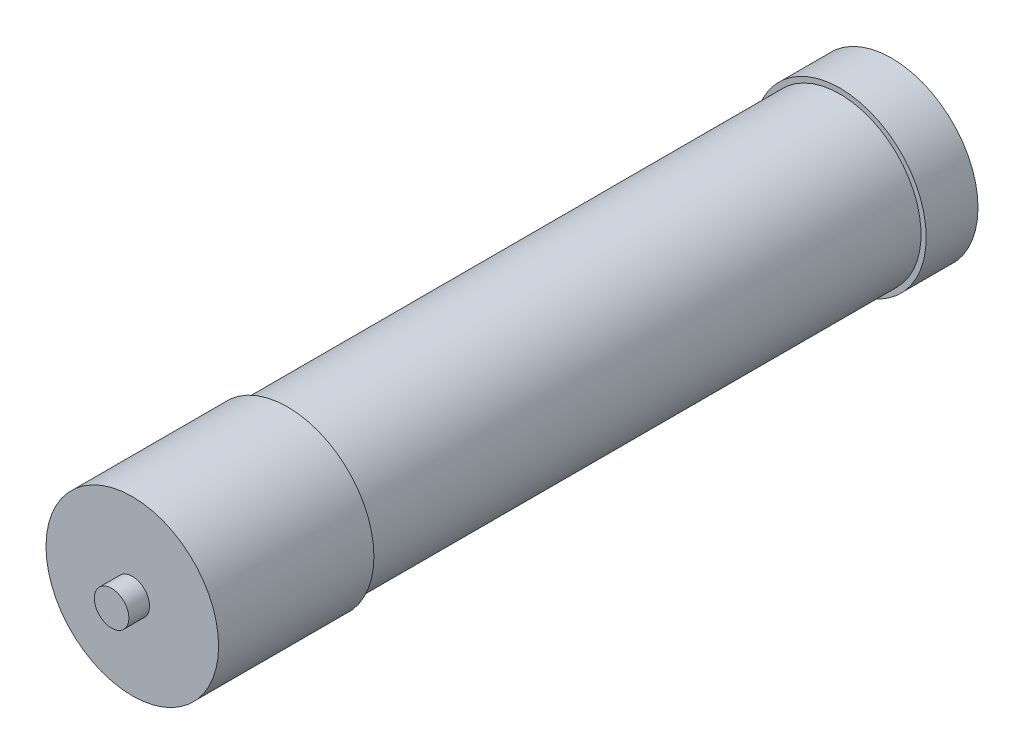
from build123d import *

# Parameters (mm, degrees)
SKETCH1_R                 = 23.5
BOSS_EXTRUDE1_DEPTH       = 110
SKETCH2_R                 = 5
BOSS_EXTRUDE2_DEPTH       = 6
SKETCH5_R                 = 25
BOSS_EXTRUDE5_DEPTH       = 45
BOSS_EXTRUDE6_START       = -15
SKETCH6_R                 = 25
BOSS_EXTRUDE6_DEPTH       = 15
M4X0_7_TAPPED_HOLE1_D     = 3.3
M4X0_7_TAPPED_HOLE1_DEPTH = 20
M4X0_7_TAPPED_HOLE1_TIP   = 0.991420021


with BuildPart() as part:
    # Sketch1 → Boss-Extrude1 (new, symmetric)
    with BuildSketch(Plane.XY):
        Circle(SKETCH1_R)
    extrude(amount=BOSS_EXTRUDE1_DEPTH, both=True)

    # Sketch2 → Boss-Extrude2 (add)
    with BuildSketch(Plane.XY.offset(110)):
        Circle(SKETCH2_R)
    extrude(amount=BOSS_EXTRUDE2_DEPTH)

    # Sketch5 → Boss-Extrude5 (add)
    with BuildSketch(Plane.XY.offset(110)):
        Circle(SKETCH5_R)
    extrude(amount=-BOSS_EXTRUDE5_DEPTH)

    # Sketch6 → Boss-Extrude6 (add)
    with BuildSketch(Plane(origin=(0, 0, -110), x_dir=(-1, 0, 0), z_dir=(0, 0, -1)).offset(BOSS_EXTRUDE6_START)):
        with Locations(Location((0, 0, 0), (0, 0, 180))):
            Circle(SKETCH6_R)
    extrude(amount=BOSS_EXTRUDE6_DEPTH)

    # M4x0.7 Tapped Hole1
    with Locations(Plane(origin=(0, 17.5, -110), x_dir=(-1, 0, 0), z_dir=(0, 0, -1))):
        with Locations((0, 0), (17.5, -17.5), (0, -35), (-17.5, -17.5)):
            Hole(M4X0_7_TAPPED_HOLE1_D / 2, depth=M4X0_7_TAPPED_HOLE1_DEPTH)
            with Locations((0, 0, -(M4X0_7_TAPPED_HOLE1_DEPTH + M4X0_7_TAPPED_HOLE1_TIP / 2))):  # 118° drill point
                Cone(0, M4X0_7_TAPPED_HOLE1_D / 2, M4X0_7_TAPPED_HOLE1_TIP, mode=Mode.SUBTRACT)


solid = part.part
